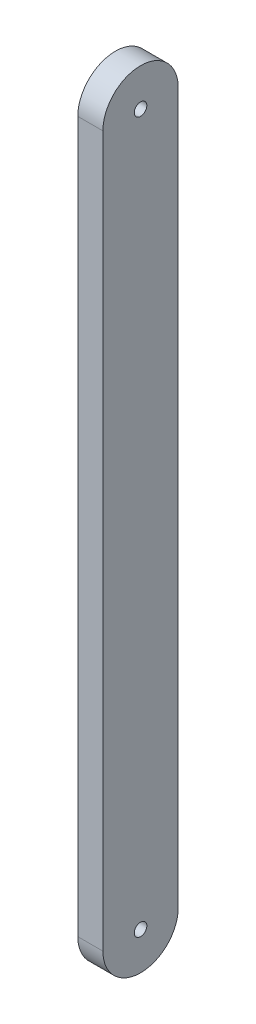
from build123d import *

# Parameters (mm, degrees)
EXTRUDE_1_DEPTH     = 10
SKETCH_3_R          = 2.5
CUT_EXTRUDE_1_DEPTH = 10


with BuildPart() as part:
    # 草图2 → 凸台-拉伸1 (new body)
    with BuildSketch(Plane(origin=(0, 0, 0), x_dir=(0, 0, -1), z_dir=(1, 0, 0))):
        with BuildLine():
            Line((0, 0), (0, 282.909))
            ThreePointArc((0, 282.909), (15, 297.909), (30, 282.909))
            Line((30, 282.909), (30, 0))
            ThreePointArc((30, 0), (15, -15), (0, 0))
        make_face()
    extrude(amount=EXTRUDE_1_DEPTH)

    # 草图3 → 切除-拉伸1 (cut)
    with BuildSketch(Plane.ZY):
        with Locations((-15, 0)):
            Circle(SKETCH_3_R)
        with Locations(Location((-15, 282.909, 0), (0, 0, 180))):
            Circle(SKETCH_3_R)
    extrude(amount=-CUT_EXTRUDE_1_DEPTH, mode=Mode.SUBTRACT)


solid = part.part
